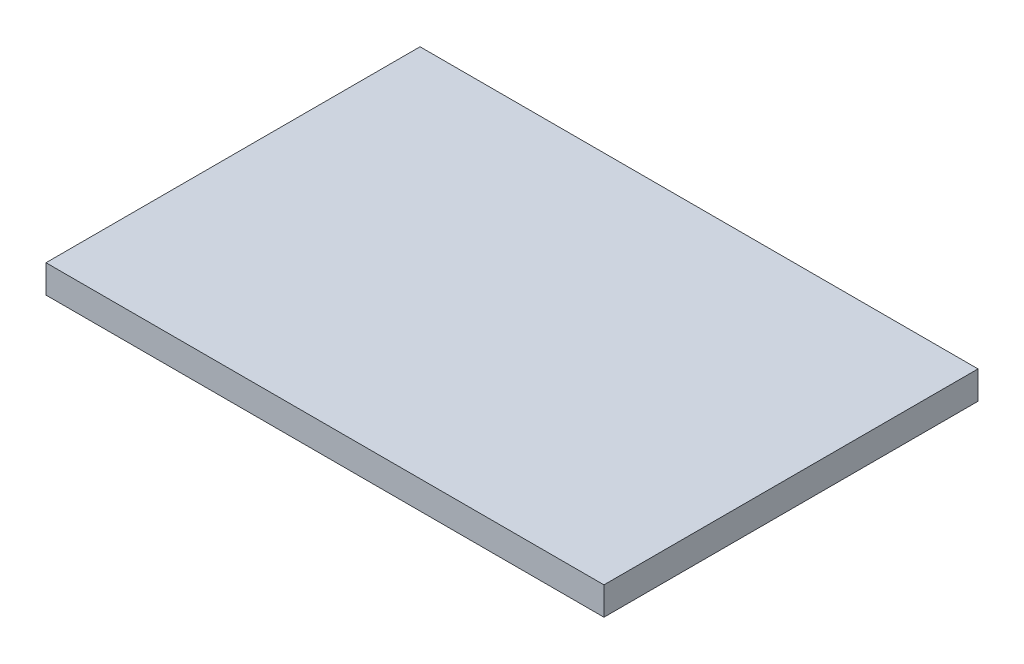
from build123d import *

# Parameters (mm, degrees)
CROQUIS1_W              = 358
CROQUIS1_H              = 240
SALIENTE_EXTRUIR1_DEPTH = 18


with BuildPart() as part:
    # Croquis1 → Saliente-Extruir1 (new body)
    with BuildSketch(Plane(origin=(0, 0, 0), x_dir=(1, 0, 0), z_dir=(0, 1, 0))):
        Rectangle(CROQUIS1_W, CROQUIS1_H)
    extrude(amount=SALIENTE_EXTRUIR1_DEPTH)


solid = part.part
